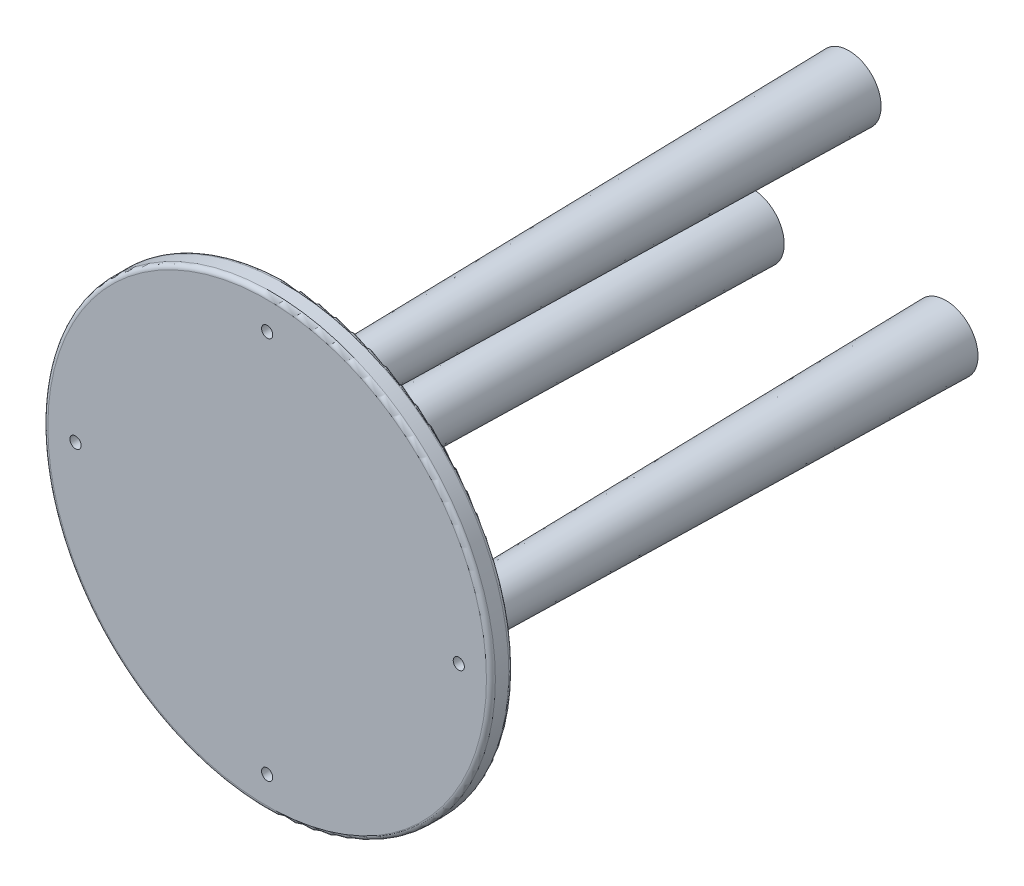
from build123d import *

# Parameters (mm, degrees)
SKETCH1_R                     = 100
BOSS_EXTRUDE1_DEPTH           = 10
SKETCH2_R                     = 10
BOSS_EXTRUDE2_DEPTH           = 250
BOSS_EXTRUDE2_DRAFT           = 1
BOSS_EXTRUDE2_PROFILE_2_DEPTH = 250
BOSS_EXTRUDE2_PROFILE_2_DRAFT = 1
BOSS_EXTRUDE2_PROFILE_3_DEPTH = 250
BOSS_EXTRUDE2_PROFILE_3_DRAFT = 1
FILLET1_R                     = 2
FILLET2_R                     = 2
CUT_EXTRUDE1_REACH            = 297.973
SKETCH4_R                     = 2.5
FILLET3_R                     = 4
CIRPATTERN1_COUNT             = 4


with BuildPart() as part:
    # Sketch1 → Boss-Extrude1 (new body)
    with BuildSketch(Plane.XY):
        Circle(SKETCH1_R)
    extrude(amount=BOSS_EXTRUDE1_DEPTH)


with BuildPart() as boss_extrude2_tool:
    # Sketch2 → Boss-Extrude2 (with draft: the straight prism first)
    with BuildSketch(Plane.XY):
        with Locations((0, 50)):
            Circle(SKETCH2_R)
    extrude(amount=-BOSS_EXTRUDE2_DEPTH)
    # Boss-Extrude2: the draft: its side faces are tilted about the plane it starts from
    boss_extrude2_sides = [boss_extrude2_tool.faces().sort_by_distance(p)[0] for p in [
        (-10, 50, -125),
    ]]
    draft(boss_extrude2_sides, Plane.XY, BOSS_EXTRUDE2_DRAFT)


with BuildPart() as part_1:
    add(part.part)

    # Boss-Extrude2: add boss_extrude2_tool
    add(boss_extrude2_tool.part)


with BuildPart() as boss_extrude2_profile_2_tool:
    # Sketch2 → Boss-Extrude2 profile 2 (with draft: the straight prism first)
    with BuildSketch(Plane.XY):
        with Locations((43.301270189, -25)):
            Circle(SKETCH2_R)
    extrude(amount=-BOSS_EXTRUDE2_PROFILE_2_DEPTH)
    # Boss-Extrude2 profile 2: the draft: its side faces are tilted about the plane it starts from
    boss_extrude2_profile_2_sides = [boss_extrude2_profile_2_tool.faces().sort_by_distance(p)[0] for p in [
        (33.301270189, -25, -125),
    ]]
    draft(boss_extrude2_profile_2_sides, Plane.XY, BOSS_EXTRUDE2_PROFILE_2_DRAFT)


with BuildPart() as part_2:
    add(part_1.part)

    # Boss-Extrude2 profile 2: add boss_extrude2_profile_2_tool
    add(boss_extrude2_profile_2_tool.part)


with BuildPart() as boss_extrude2_profile_3_tool:
    # Sketch2 → Boss-Extrude2 profile 3 (with draft: the straight prism first)
    with BuildSketch(Plane.XY):
        with Locations((-43.301270189, -25)):
            Circle(SKETCH2_R)
    extrude(amount=-BOSS_EXTRUDE2_PROFILE_3_DEPTH)
    # Boss-Extrude2 profile 3: the draft: its side faces are tilted about the plane it starts from
    boss_extrude2_profile_3_sides = [boss_extrude2_profile_3_tool.faces().sort_by_distance(p)[0] for p in [
        (-53.301270189, -25, -125),
    ]]
    draft(boss_extrude2_profile_3_sides, Plane.XY, BOSS_EXTRUDE2_PROFILE_3_DRAFT)


with BuildPart() as part_3:
    add(part_2.part)

    # Boss-Extrude2 profile 3: add boss_extrude2_profile_3_tool
    add(boss_extrude2_profile_3_tool.part)

    # Fillet1
    fillet1_edges = [part_3.edges().sort_by_distance(p)[0] for p in [
        (-100, 0, 10),
    ]]
    fillet(fillet1_edges, radius=FILLET1_R)

    # Fillet2
    fillet2_edges = [part_3.edges().sort_by_distance(p)[0] for p in [
        (-100, 0, 0),
    ]]
    fillet(fillet2_edges, radius=FILLET2_R)

    # Sketch4 → Cut-Extrude1 (cut, up to next)
    with BuildSketch(Plane.XY.offset(10), mode=Mode.PRIVATE) as cut_extrude1_sk1:
        with Locations((0, 85.59)):
            Circle(SKETCH4_R)
    cut_extrude1_tool1 = extrude(cut_extrude1_sk1.sketch, amount=-CUT_EXTRUDE1_REACH, mode=Mode.PRIVATE) & part_3.part
    cut_extrude1 = cut_extrude1_tool1.solids().sort_by_distance((0, 85.59, 10))[0]
    add(cut_extrude1, mode=Mode.SUBTRACT)

    # Fillet3
    fillet3_edges = [part_3.edges().sort_by_distance(p)[0] for p in [
        (-53.301270189, -25, 0),
        (-10, 50, 0),
        (33.301270189, -25, 0),
    ]]
    fillet(fillet3_edges, radius=FILLET3_R)

    # CirPattern1: Cut-Extrude1 ×4 about axis
    cirpattern1_axis = Axis((0, -0.055735719, 0), (0, 0, 1))
    for i in range(1, CIRPATTERN1_COUNT):
        add(cut_extrude1.rotate(cirpattern1_axis, i * 360 / CIRPATTERN1_COUNT), mode=Mode.SUBTRACT)


solid = part_3.part
